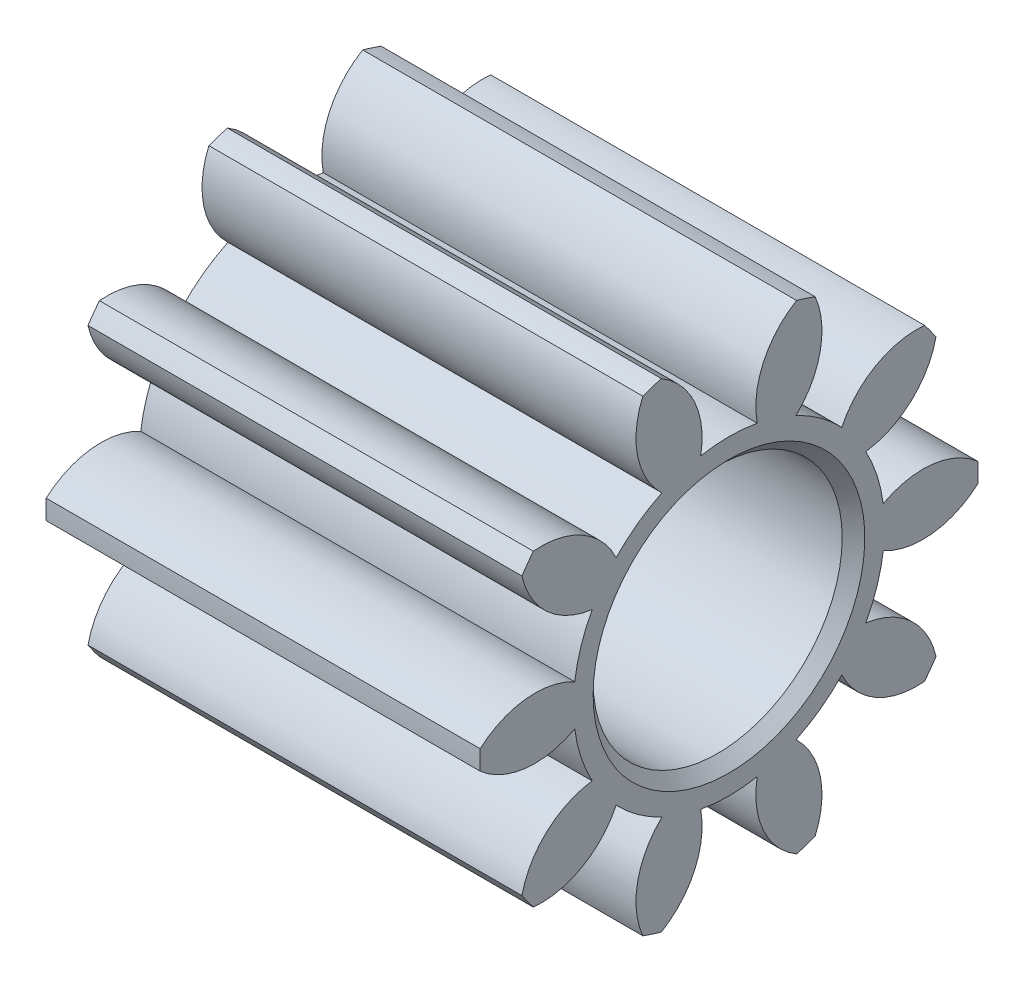
from build123d import *

# Parameters (mm, degrees)
BASPROSKE_W        = 11.5
BASPROSKE_H        = 6.6
TOOTHCUT_DEPTH     = 15.811144453
TEETHCUTS_COUNT    = 10
TEETHCUTS_ANGLE    = 324
BORSKE_R           = 1.5
BORE_DEPTH         = 50.0003556
SKETCH2_R          = 3.3
CUT_EXTRUDE1_DEPTH = 5.5
CUT_EXTRUDE2_START = -3.3
SKETCH3_R          = 3.3
CUT_EXTRUDE2_DEPTH = 3.3
SKETCH4_R          = 1.65
CUT_EXTRUDE3_DEPTH = 13.294146319
CHAMFER1_SIZE      = 0.3


with BuildPart() as part:
    # BasProSke → Base-Revolve (revolve)
    with BuildSketch(Plane(origin=(0, 0, 0), x_dir=(1, 0, 0), z_dir=(0, 1, 0)), mode=Mode.PRIVATE) as base_revolve_sk:
        with Locations((5.75, 3.3)):
            Rectangle(BASPROSKE_W, BASPROSKE_H)
    revolve(base_revolve_sk.sketch.rotate(Axis((-10, 0, 0), (1, 0, 0)), 180), axis=Axis((-10, 0, 0), (1, 0, 0)))

    # TooCutSke → ToothCut (cut, through all)
    with BuildSketch(Plane(origin=(0, 0, 0), x_dir=(0, 0, -1), z_dir=(1, 0, 0))):
        with BuildLine():
            ThreePointArc((0.749284073, 4.055360573), (0, 4.124), (-0.749284073, 4.055360573))
            ThreePointArc((-0.749284073, 4.055360573), (-0.916574147, 5.384052291), (-1.823298638, 6.369576692))
            ThreePointArc((-1.823298638, 6.369576692), (0, 6.6254), (1.823298638, 6.369576692))
            ThreePointArc((1.823298638, 6.369576692), (0.916574147, 5.384052291), (0.749284073, 4.055360573))
        make_face()
    toothcut = extrude(amount=TOOTHCUT_DEPTH, mode=Mode.SUBTRACT)

    # TeethCuts: ToothCut ×10 about axis
    teethcuts_axis = Axis((-10, 0, 0), (1, 0, 0))
    for i in range(1, TEETHCUTS_COUNT):
        add(toothcut.rotate(teethcuts_axis, i * TEETHCUTS_ANGLE / (TEETHCUTS_COUNT - 1)), mode=Mode.SUBTRACT)

    # BorSke → Bore (cut, symmetric)
    with BuildSketch(Plane(origin=(0, 0, 0), x_dir=(0, 0, -1), z_dir=(1, 0, 0))):
        with Locations(Location((0, 0, 0), (0, 0, 180))):
            Circle(BORSKE_R)
    extrude(amount=BORE_DEPTH, both=True, mode=Mode.SUBTRACT)

    # Sketch2 → Cut-Extrude1 (cut)
    with BuildSketch(Plane(origin=(11.5, 0, 0), x_dir=(0, 0, -1), z_dir=(1, 0, 0))):
        Circle(SKETCH2_R)
    extrude(amount=-CUT_EXTRUDE1_DEPTH, mode=Mode.SUBTRACT)

    # Sketch3 → Cut-Extrude2 (cut)
    with BuildSketch(Plane.ZY.offset(CUT_EXTRUDE2_START)):
        with Locations(Location((0, 0, 0), (0, 0, 180))):
            Circle(SKETCH3_R)
    extrude(amount=CUT_EXTRUDE2_DEPTH, mode=Mode.SUBTRACT)

    # Sketch4 → Cut-Extrude3 (cut, through all)
    with BuildSketch(Plane.ZY.offset(-3.3)):
        Circle(SKETCH4_R)
    extrude(amount=-CUT_EXTRUDE3_DEPTH, mode=Mode.SUBTRACT)

    # Chamfer1
    chamfer1_edges = [part.edges().sort_by_distance(p)[0] for p in [
        (11.5, 0, 3.3),
        (0, 0, 3.3),
    ]]
    chamfer(chamfer1_edges, length=CHAMFER1_SIZE)


solid = part.part
